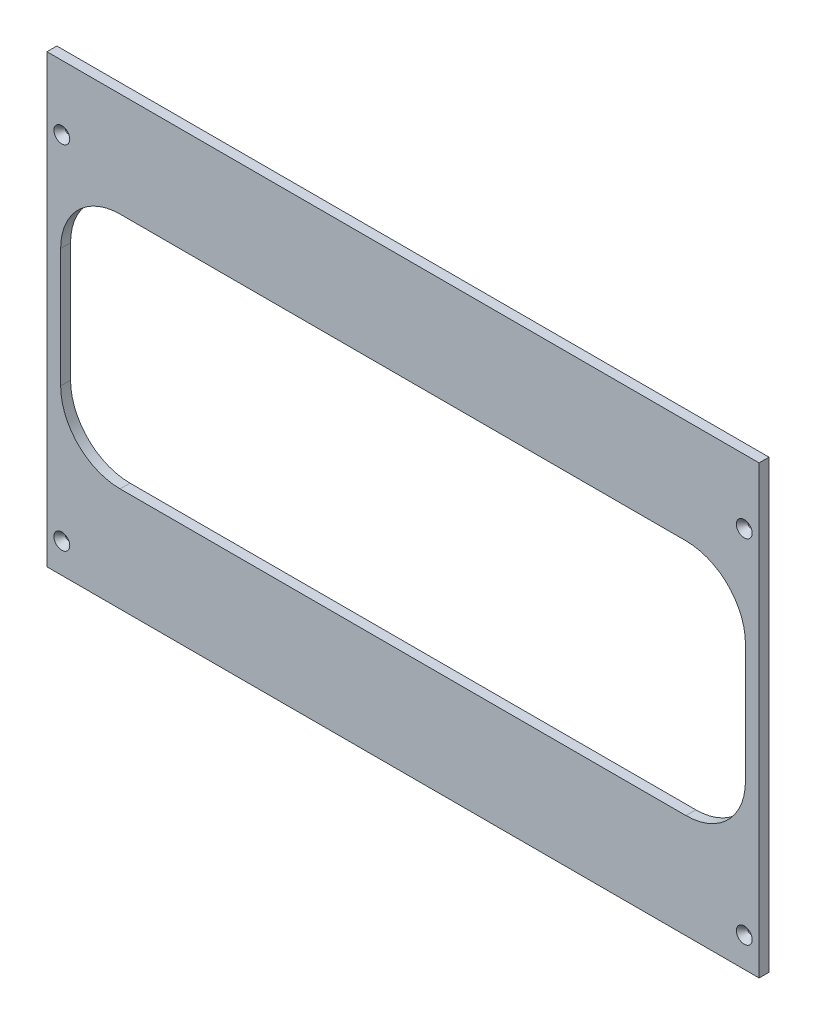
from build123d import *

# Parameters (mm, degrees)
SKETCH1_W           = 456.177532672
SKETCH1_H           = 285.75
BOSS_EXTRUDE1_DEPTH = 6.35
CUT_EXTRUDE1_REACH  = 367.675
SKETCH2_W           = 438.651532672
SKETCH2_H           = 152.4
FILLET1_R           = 38.1
HOLE1_D             = 3.175
HOLE1_DEPTH         = 38.1
HOLE1_CSINK_D       = 10.16
HOLE1_CSINK_ANGLE   = 82
HOLE1_TIP           = 0.953866233


with BuildPart() as part:
    # Sketch1 → Boss-Extrude1 (new body)
    with BuildSketch(Plane.XY):
        with Locations((0, -142.875)):
            Rectangle(SKETCH1_W, SKETCH1_H)
    extrude(amount=BOSS_EXTRUDE1_DEPTH)

    # Sketch2 → Cut-Extrude1 (cut, up to next)
    with BuildSketch(Plane.XY.offset(6.35), mode=Mode.PRIVATE) as cut_extrude1_sk1:
        with Locations((0, -142.875)):
            Rectangle(SKETCH2_W, SKETCH2_H)
    cut_extrude1_tool1 = extrude(cut_extrude1_sk1.sketch, amount=-CUT_EXTRUDE1_REACH, mode=Mode.PRIVATE) & part.part
    add(cut_extrude1_tool1.solids().sort_by_distance((0, -142.875, 6.35))[0], mode=Mode.SUBTRACT)

    # Fillet1
    fillet1_edges = [part.edges().sort_by_distance(p)[0] for p in [
        (219.325766336, -66.675, 3.175),
        (219.325766336, -219.075, 3.175),
        (-219.325766336, -219.075, 3.175),
        (-219.325766336, -66.675, 3.175),
    ]]
    fillet(fillet1_edges, radius=FILLET1_R)

    # Hole1
    with Locations(Plane.XY.offset(6.35)):
        with Locations((-218.563766336, -266.7), (-218.563766336, -41.275), (218.563766336, -266.7), (218.563766336, -41.275)):
            CounterSinkHole(HOLE1_D / 2, HOLE1_CSINK_D / 2, depth=HOLE1_DEPTH, counter_sink_angle=HOLE1_CSINK_ANGLE)
            with Locations((0, 0, -(HOLE1_DEPTH + HOLE1_TIP / 2))):  # 118° drill point
                Cone(0, HOLE1_D / 2, HOLE1_TIP, mode=Mode.SUBTRACT)


solid = part.part
